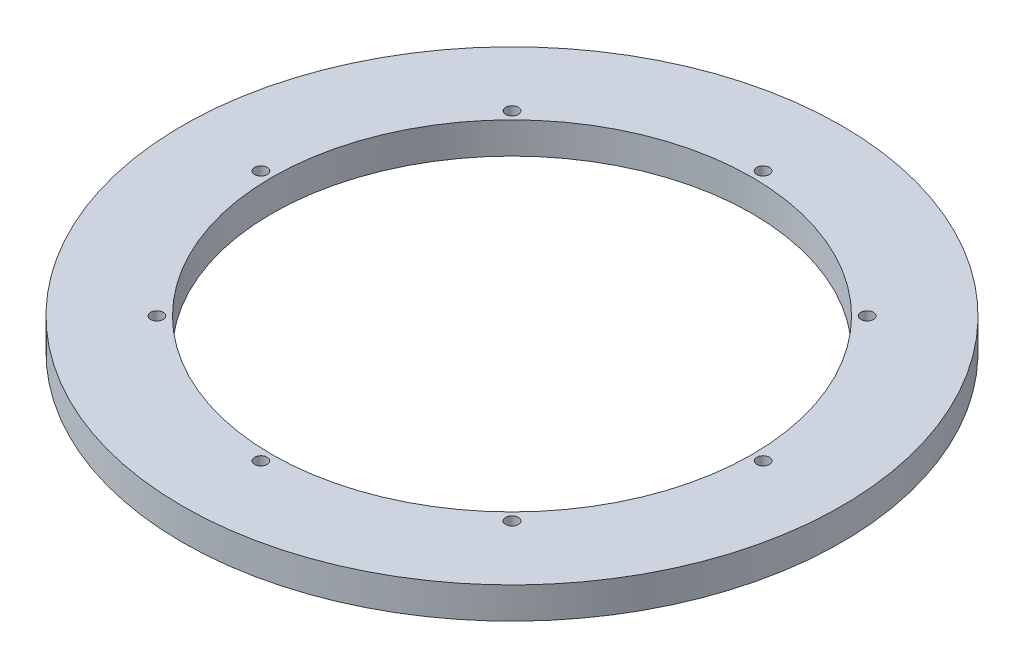
from build123d import *

# Parameters (mm, degrees)
SKETCH1_W          = 85.5
SKETCH1_H          = 30
SKETCH2_R          = 6
CUT_EXTRUDE1_DEPTH = 447.486281984


with BuildPart() as part:
    # Sketch1 → Revolve1 (revolve)
    with BuildSketch(Plane(origin=(0, 0, 0), x_dir=(0, 0, -1), z_dir=(1, 0, 0)), mode=Mode.PRIVATE) as revolve1_sk:
        with Locations((-272.25, 0)):
            Rectangle(SKETCH1_W, SKETCH1_H)
    revolve(revolve1_sk.sketch.rotate(Axis((0, -3585.421948748, 0), (0, 1, 0)), 180), axis=Axis((0, -3585.421948748, 0), (0, 1, 0)))

    # Sketch2 → Cut-Extrude1 (cut, through all)
    with BuildSketch(Plane(origin=(0, 15, 0), x_dir=(1, 0, 0), z_dir=(0, 1, 0))):
        with Locations(Location((0, 240, 0), (0, 0, 270))):
            Circle(SKETCH2_R)
        with Locations(Location((169.705627485, 169.705627485, 0), (0, 0, 270))):
            Circle(SKETCH2_R)
        with Locations(Location((240, 0, 0), (0, 0, 270))):
            Circle(SKETCH2_R)
        with Locations(Location((169.705627485, -169.705627485, 0), (0, 0, 270))):
            Circle(SKETCH2_R)
        with Locations(Location((0, -240, 0), (0, 0, 270))):
            Circle(SKETCH2_R)
        with Locations(Location((-169.705627485, -169.705627485, 0), (0, 0, 270))):
            Circle(SKETCH2_R)
        with Locations(Location((-240, 0, 0), (0, 0, 270))):
            Circle(SKETCH2_R)
        with Locations(Location((-169.705627485, 169.705627485, 0), (0, 0, 270))):
            Circle(SKETCH2_R)
    extrude(amount=-CUT_EXTRUDE1_DEPTH, mode=Mode.SUBTRACT)


solid = part.part
